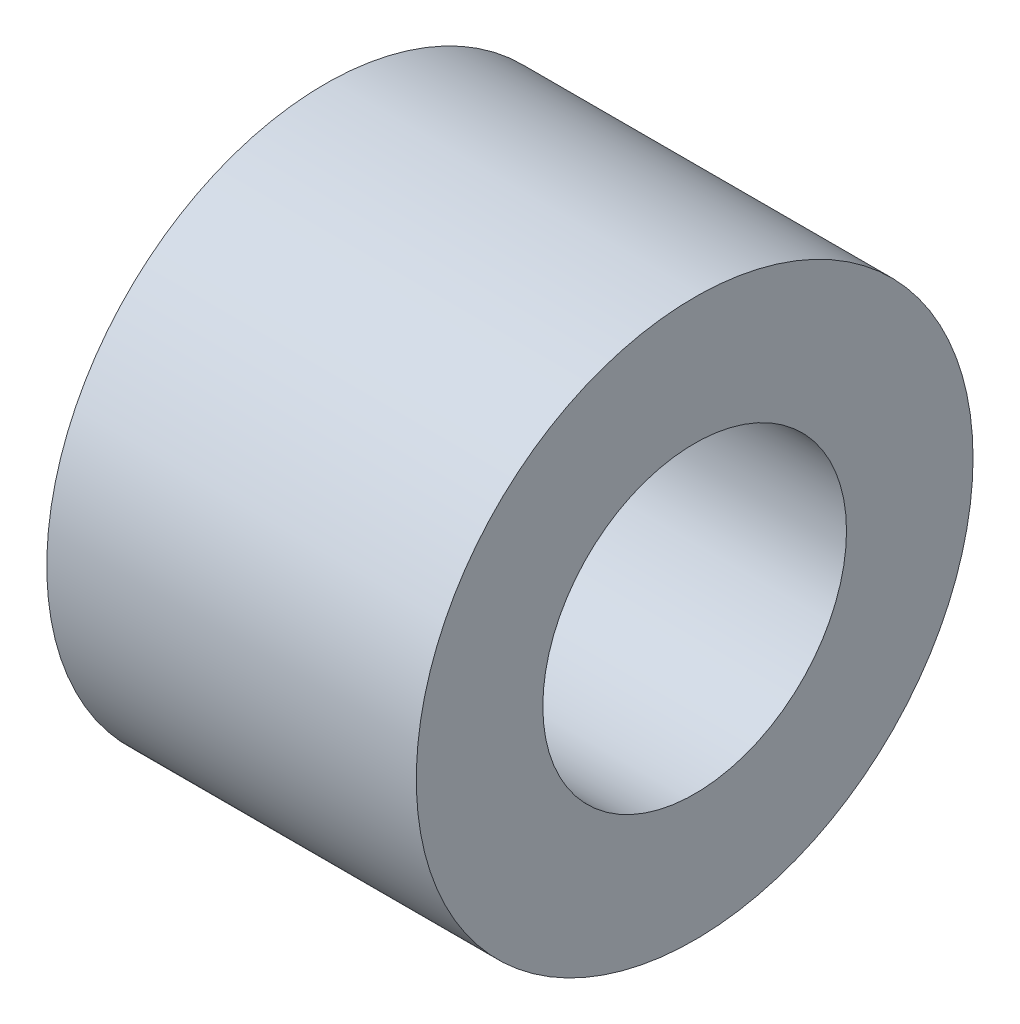
from build123d import *

# Parameters (mm, degrees)
SKETCH_2_R      = 5.5
SKETCH_2_R_2    = 3
EXTRUDE_1_DEPTH = 7.3


with BuildPart() as part:
    # 草图2 → 凸台-拉伸1 (new body)
    with BuildSketch(Plane(origin=(0, 0, 0), x_dir=(0, 0, -1), z_dir=(1, 0, 0))):
        Circle(SKETCH_2_R)
        Circle(SKETCH_2_R_2, mode=Mode.SUBTRACT)
    extrude(amount=EXTRUDE_1_DEPTH)


solid = part.part
